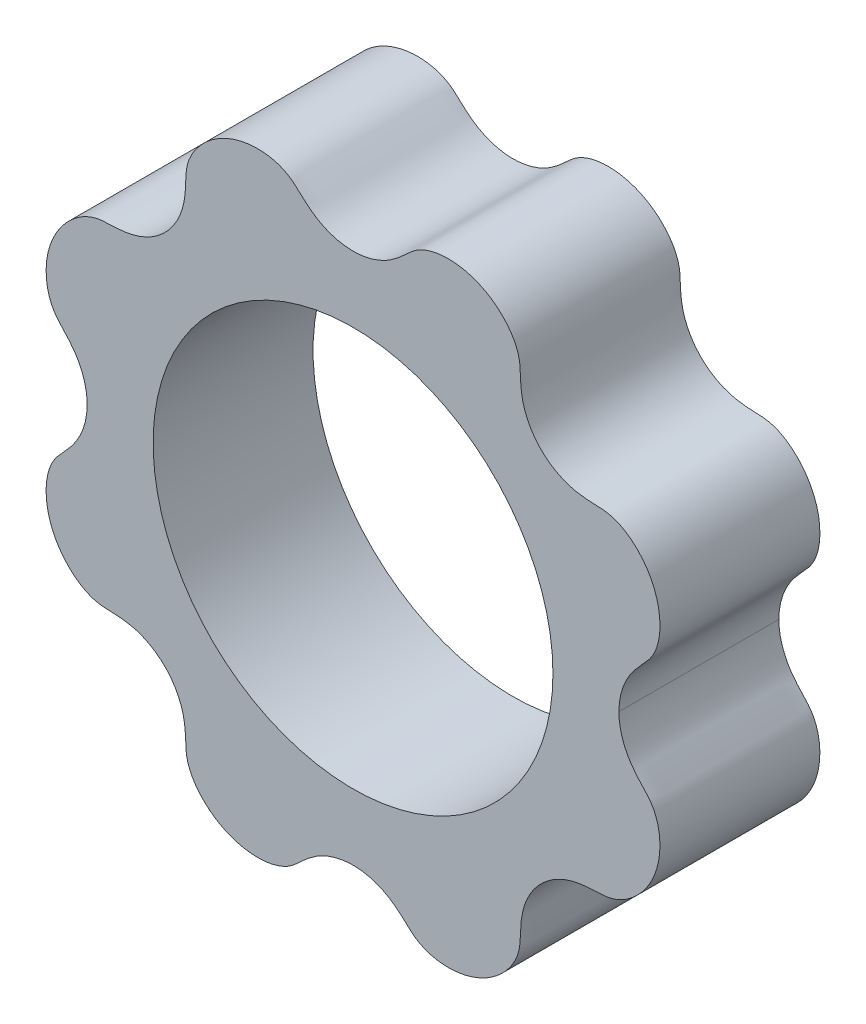
from build123d import *

# Parameters (mm, degrees)
ESQUISSE1_R        = 5
BOSS_EXTRU_4_DEPTH = 4


with BuildPart() as part:
    # Esquisse1 → Boss.-Extru.4 (new body)
    with BuildSketch(Plane.XY):
        with BuildLine():
            add(Edge.make_bspline(
                [(6.65, 0), (6.65, 0.302665813), (6.776109812, 0.76532414), (7.161820853, 1.250136321), (7.559534186, 1.634881918), (7.735196939, 2.313971742), (7.58421294, 3.141450307), (7.105602316, 3.833633408), (6.501973727, 4.189160415), (5.948209907, 4.180673225), (5.331858256, 4.250545148), (4.642883243, 4.642942724), (4.250773905, 5.332070698), (4.180100761, 5.948213901), (4.189340968, 6.5013724), (3.833416981, 7.105854746), (3.141488935, 7.584186537), (2.313734238, 7.735167179), (1.635220614, 7.559803153), (1.249826385, 7.161988112), (0.764689481, 6.775909436), (-6.998e-05, 6.566016096), (-0.764591661, 6.776104732), (-1.250250394, 7.161799677), (-1.6348573, 7.559481849), (-2.313948371, 7.735240083), (-3.141466291, 7.584179619), (-3.83335836, 7.105768028), (-4.189397275, 6.501687164), (-4.180018489, 5.948077923), (-4.250817499, 5.332134247), (-4.642878922, 4.642905386), (-5.331853724, 4.250557605), (-5.948216238, 4.180669117), (-6.501971789, 4.189161603), (-7.105597407, 3.833628045), (-7.584235519, 3.141470012), (-7.735098049, 2.31392413), (-7.559782529, 1.635109016), (-7.161635625, 1.250132179), (-6.776191228, 0.765289108), (-6.65, 0.302657352), (-6.65, 0)],
                knots=[0.065779602, 0.065779602, 0.065779602, 0.065779602, 0.092918377, 0.106487765, 0.120057152, 0.147195927, 0.174334702, 0.201473477, 0.228612252, 0.242181639, 0.255751026, 0.282889801, 0.310028576, 0.323597963, 0.337167351, 0.364306126, 0.391444901, 0.418583675, 0.44572245, 0.459291838, 0.472861225, 0.5, 0.527138775, 0.540708162, 0.55427755, 0.581416325, 0.608555099, 0.635693874, 0.662832649, 0.676402037, 0.689971424, 0.717110199, 0.744248974, 0.757818361, 0.771387748, 0.798526523, 0.825665298, 0.852804073, 0.879942848, 0.893512235, 0.907081623, 0.934220398, 0.934220398, 0.934220398, 0.934220398], degree=3))
            add(Edge.make_bspline(
                [(-6.65, 0), (-6.65, -0.302657352), (-6.776191228, -0.765289108), (-7.161635625, -1.250132179), (-7.559782529, -1.635109016), (-7.735098049, -2.31392413), (-7.584235519, -3.141470012), (-7.105597407, -3.833628045), (-6.501971789, -4.189161603), (-5.948216238, -4.180669117), (-5.331853724, -4.250557605), (-4.642878922, -4.642905386), (-4.250817499, -5.332134247), (-4.180018489, -5.948077923), (-4.189397275, -6.501687164), (-3.83335836, -7.105768028), (-3.141466291, -7.584179619), (-2.313948371, -7.735240083), (-1.6348573, -7.559481849), (-1.250250394, -7.161799677), (-0.764591661, -6.776104732), (-6.998e-05, -6.566016096), (0.764689481, -6.775909436), (1.249826385, -7.161988112), (1.635220614, -7.559803153), (2.313734238, -7.735167179), (3.141488935, -7.584186537), (3.833416981, -7.105854746), (4.189340968, -6.5013724), (4.180100761, -5.948213901), (4.250773905, -5.332070698), (4.642883243, -4.642942724), (5.331858256, -4.250545148), (5.948209907, -4.180673225), (6.501973727, -4.189160414), (7.105602316, -3.833633408), (7.58421294, -3.141450307), (7.735196939, -2.313971742), (7.559534186, -1.634881918), (7.161820853, -1.250136321), (6.776109812, -0.76532414), (6.65, -0.302665813), (6.65, 0)],
                knots=[0.065779602, 0.065779602, 0.065779602, 0.065779602, 0.092918377, 0.106487765, 0.120057152, 0.147195927, 0.174334702, 0.201473477, 0.228612252, 0.242181639, 0.255751026, 0.282889801, 0.310028576, 0.323597963, 0.337167351, 0.364306126, 0.391444901, 0.418583675, 0.44572245, 0.459291838, 0.472861225, 0.5, 0.527138775, 0.540708162, 0.55427755, 0.581416325, 0.608555099, 0.635693874, 0.662832649, 0.676402037, 0.689971424, 0.717110199, 0.744248974, 0.757818361, 0.771387748, 0.798526523, 0.825665298, 0.852804073, 0.879942848, 0.893512235, 0.907081623, 0.934220398, 0.934220398, 0.934220398, 0.934220398], degree=3))
        make_face()
        Circle(ESQUISSE1_R, mode=Mode.SUBTRACT)
    extrude(amount=BOSS_EXTRU_4_DEPTH)


solid = part.part
